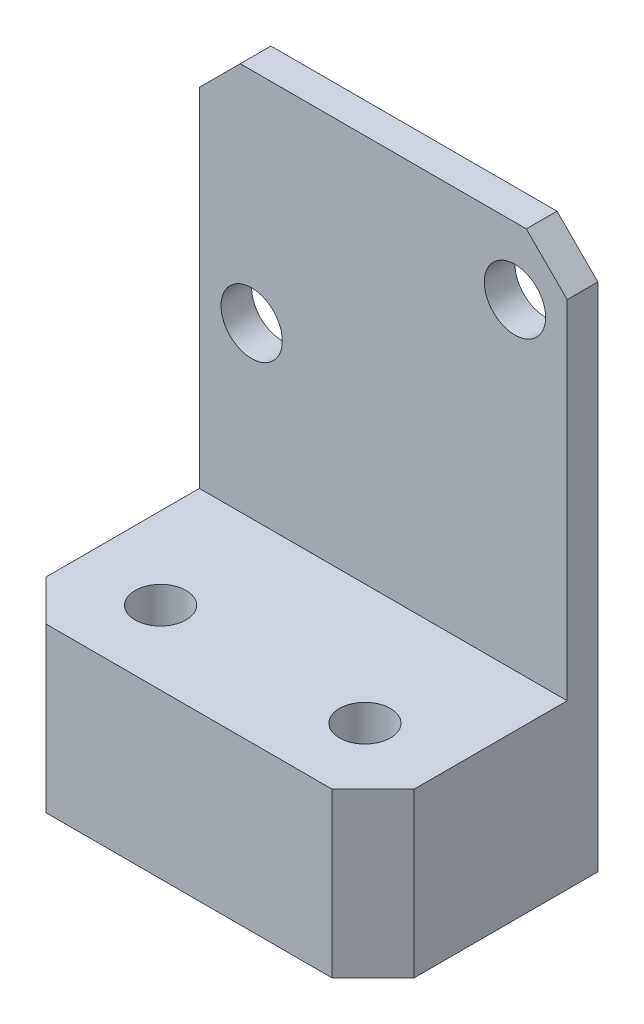
from build123d import *

# Parameters (mm, degrees)
SKETCH1_W             = 18
SKETCH1_H             = 27
EXTRUDE1_DEPTH        = 11
SKETCH2_W             = 18
SKETCH2_H             = 19
EXTRUDE2_DEPTH        = 9.5
SKETCH3_R             = 1.5
EXTRUDE3_DEPTH        = 1.5
SKETCH4_R             = 1.25
EXTRUDE4_DEPTH        = 8
M3_TAPPED_HOLE1_D     = 2.5
M3_TAPPED_HOLE1_DEPTH = 11.5
M3_TAPPED_HOLE1_TIP   = 0.751075774
CHAMFER1_SIZE         = 2


with BuildPart() as part:
    # Sketch1 → Extrude1 (new body)
    with BuildSketch(Plane.XY):
        with Locations((0, -6.5)):
            Rectangle(SKETCH1_W, SKETCH1_H)
    extrude(amount=EXTRUDE1_DEPTH)

    # Sketch2 → Extrude2 (cut)
    with BuildSketch(Plane.XY.offset(11)):
        with Locations((0, -2.5)):
            Rectangle(SKETCH2_W, SKETCH2_H)
    extrude(amount=-EXTRUDE2_DEPTH, mode=Mode.SUBTRACT)

    # Sketch3 → Extrude3 (cut)
    with BuildSketch(Plane.XY.offset(1.5)):
        with Locations((6.443229004, 3.72)):
            Circle(SKETCH3_R)
        with Locations((-6.443229004, -3.72)):
            Circle(SKETCH3_R)
    extrude(amount=-EXTRUDE3_DEPTH, mode=Mode.SUBTRACT)

    # Sketch4 → Extrude4 (cut)
    with BuildSketch(Plane(origin=(0, -12, 0), x_dir=(1, 0, 0), z_dir=(0, 1, 0))):
        with Locations(Location((-5, -7.4, 0), (0, 0, 180))):
            Circle(SKETCH4_R)
        with Locations(Location((5, -7.4, 0), (0, 0, 180))):
            Circle(SKETCH4_R)
    extrude(amount=-EXTRUDE4_DEPTH, mode=Mode.SUBTRACT)

    # M3 Tapped Hole1
    with Locations(Plane(origin=(5, -20, 7.4), x_dir=(0, 0, -1), z_dir=(0, -1, 0))):
        with Locations((0, 0), (0, -10)):
            Hole(M3_TAPPED_HOLE1_D / 2, depth=M3_TAPPED_HOLE1_DEPTH)
            with Locations((0, 0, -(M3_TAPPED_HOLE1_DEPTH + M3_TAPPED_HOLE1_TIP / 2))):  # 118° drill point
                Cone(0, M3_TAPPED_HOLE1_D / 2, M3_TAPPED_HOLE1_TIP, mode=Mode.SUBTRACT)

    # Chamfer1
    chamfer1_edges = [part.edges().sort_by_distance(p)[0] for p in [
        (9, -16, 11),
        (-9, -16, 11),
        (-9, 7, 0.75),
        (9, 7, 0.75),
    ]]
    chamfer(chamfer1_edges, length=CHAMFER1_SIZE)


solid = part.part
